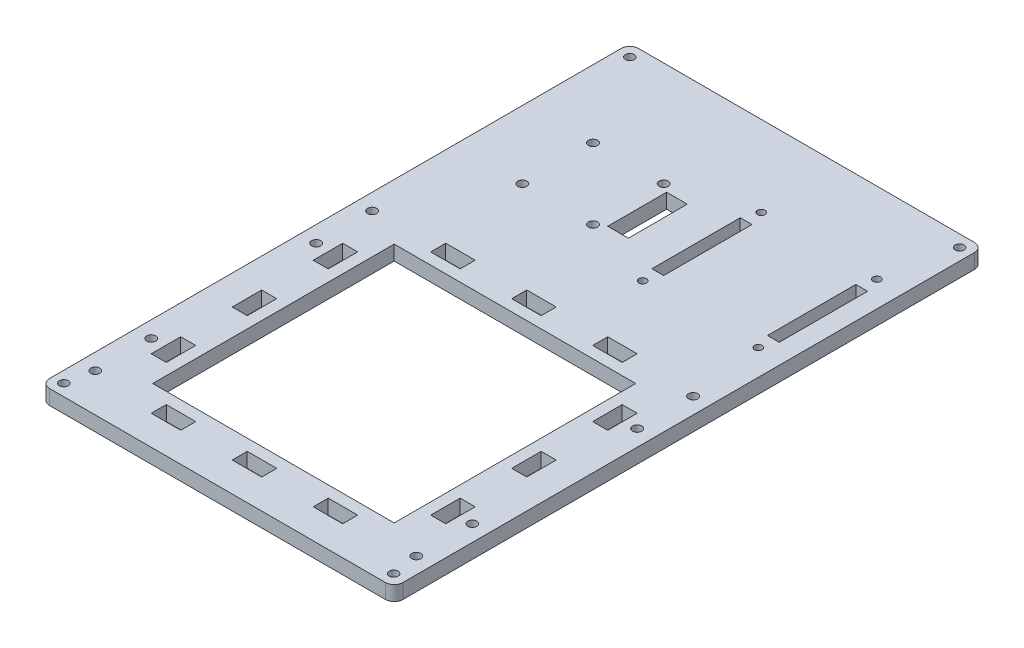
from build123d import *

# Parameters (mm, degrees)
SKETCH1_W           = 120
SKETCH1_H           = 200
SKETCH1_R           = 1.5
BOSS_EXTRUDE1_DEPTH = 5
CUT_EXTRUDE1_REACH  = 118.726
SKETCH4_W           = 5.1
SKETCH4_H           = 10
SKETCH4_W_2         = 10
SKETCH4_H_2         = 5.1
SKETCH4_W_3         = 82
SKETCH4_H_3         = 82
SKETCH5_R           = 1.55
SKETCH5_W           = 7.015063312
SKETCH5_H           = 20
CUT_EXTRUDE3_DEPTH  = 117.726175299
SKETCH6_W           = 4
SKETCH6_H           = 30
SKETCH6_R           = 1.3
CUT_EXTRUDE5_DEPTH  = 10
SKETCH7_R           = 1.55
CUT_EXTRUDE6_DEPTH  = 117.726175299
FILLET1_R           = 3


with BuildPart() as part:
    # Sketch1 → Boss-Extrude1 (new body)
    with BuildSketch(Plane(origin=(0, 0, 0), x_dir=(1, 0, 0), z_dir=(0, 1, 0))):
        Rectangle(SKETCH1_W, SKETCH1_H)
        with Locations(Location((-56, 96, 0), (0, 0, 270))):
            Circle(SKETCH1_R, mode=Mode.SUBTRACT)
        with Locations(Location((56, 96, 0), (0, 0, 270))):
            Circle(SKETCH1_R, mode=Mode.SUBTRACT)
        with Locations(Location((55.822222222, -96, 0), (0, 0, 270))):
            Circle(SKETCH1_R, mode=Mode.SUBTRACT)
        with Locations(Location((-56.177777778, -96, 0), (0, 0, 270))):
            Circle(SKETCH1_R, mode=Mode.SUBTRACT)
    extrude(amount=BOSS_EXTRUDE1_DEPTH)

    # Sketch4 → Cut-Extrude1 (cut, up to next)
    with BuildSketch(Plane(origin=(0, 5, 0), x_dir=(1, 0, 0), z_dir=(0, 1, 0)), mode=Mode.PRIVATE) as cut_extrude1_sk1:
        with Locations((-47.45, -12.5)):
            Rectangle(SKETCH4_W, SKETCH4_H)
    cut_extrude1_tool1 = extrude(cut_extrude1_sk1.sketch, amount=-CUT_EXTRUDE1_REACH, mode=Mode.PRIVATE) & part.part
    # Sketch4 → Cut-Extrude1 (cut, up to next)
    with BuildSketch(Plane(origin=(0, 5, 0), x_dir=(1, 0, 0), z_dir=(0, 1, 0)), mode=Mode.PRIVATE) as cut_extrude1_sk2:
        with Locations((-47.45, -67.5)):
            Rectangle(SKETCH4_W, SKETCH4_H)
    cut_extrude1_tool2 = extrude(cut_extrude1_sk2.sketch, amount=-CUT_EXTRUDE1_REACH, mode=Mode.PRIVATE) & part.part
    # Sketch4 → Cut-Extrude1 (cut, up to next)
    with BuildSketch(Plane(origin=(0, 5, 0), x_dir=(1, 0, 0), z_dir=(0, 1, 0)), mode=Mode.PRIVATE) as cut_extrude1_sk3:
        with Locations((-47.45, -40)):
            Rectangle(SKETCH4_W, SKETCH4_H)
    cut_extrude1_tool3 = extrude(cut_extrude1_sk3.sketch, amount=-CUT_EXTRUDE1_REACH, mode=Mode.PRIVATE) & part.part
    # Sketch4 → Cut-Extrude1 (cut, up to next)
    with BuildSketch(Plane(origin=(0, 5, 0), x_dir=(1, 0, 0), z_dir=(0, 1, 0)), mode=Mode.PRIVATE) as cut_extrude1_sk4:
        with Locations((-27.5, 7.45)):
            Rectangle(SKETCH4_W_2, SKETCH4_H_2)
    cut_extrude1_tool4 = extrude(cut_extrude1_sk4.sketch, amount=-CUT_EXTRUDE1_REACH, mode=Mode.PRIVATE) & part.part
    # Sketch4 → Cut-Extrude1 (cut, up to next)
    with BuildSketch(Plane(origin=(0, 5, 0), x_dir=(1, 0, 0), z_dir=(0, 1, 0)), mode=Mode.PRIVATE) as cut_extrude1_sk5:
        with Locations((0, 7.45)):
            Rectangle(SKETCH4_W_2, SKETCH4_H_2)
    cut_extrude1_tool5 = extrude(cut_extrude1_sk5.sketch, amount=-CUT_EXTRUDE1_REACH, mode=Mode.PRIVATE) & part.part
    # Sketch4 → Cut-Extrude1 (cut, up to next)
    with BuildSketch(Plane(origin=(0, 5, 0), x_dir=(1, 0, 0), z_dir=(0, 1, 0)), mode=Mode.PRIVATE) as cut_extrude1_sk6:
        with Locations((27.5, 7.45)):
            Rectangle(SKETCH4_W_2, SKETCH4_H_2)
    cut_extrude1_tool6 = extrude(cut_extrude1_sk6.sketch, amount=-CUT_EXTRUDE1_REACH, mode=Mode.PRIVATE) & part.part
    # Sketch4 → Cut-Extrude1 (cut, up to next)
    with BuildSketch(Plane(origin=(0, 5, 0), x_dir=(1, 0, 0), z_dir=(0, 1, 0)), mode=Mode.PRIVATE) as cut_extrude1_sk7:
        with Locations((47.45, -12.5)):
            Rectangle(SKETCH4_W, SKETCH4_H)
    cut_extrude1_tool7 = extrude(cut_extrude1_sk7.sketch, amount=-CUT_EXTRUDE1_REACH, mode=Mode.PRIVATE) & part.part
    # Sketch4 → Cut-Extrude1 (cut, up to next)
    with BuildSketch(Plane(origin=(0, 5, 0), x_dir=(1, 0, 0), z_dir=(0, 1, 0)), mode=Mode.PRIVATE) as cut_extrude1_sk8:
        with Locations((47.45, -40)):
            Rectangle(SKETCH4_W, SKETCH4_H)
    cut_extrude1_tool8 = extrude(cut_extrude1_sk8.sketch, amount=-CUT_EXTRUDE1_REACH, mode=Mode.PRIVATE) & part.part
    # Sketch4 → Cut-Extrude1 (cut, up to next)
    with BuildSketch(Plane(origin=(0, 5, 0), x_dir=(1, 0, 0), z_dir=(0, 1, 0)), mode=Mode.PRIVATE) as cut_extrude1_sk9:
        with Locations((47.45, -67.5)):
            Rectangle(SKETCH4_W, SKETCH4_H)
    cut_extrude1_tool9 = extrude(cut_extrude1_sk9.sketch, amount=-CUT_EXTRUDE1_REACH, mode=Mode.PRIVATE) & part.part
    # Sketch4 → Cut-Extrude1 (cut, up to next)
    with BuildSketch(Plane(origin=(0, 5, 0), x_dir=(1, 0, 0), z_dir=(0, 1, 0)), mode=Mode.PRIVATE) as cut_extrude1_sk10:
        with Locations((0, -87.45)):
            Rectangle(SKETCH4_W_2, SKETCH4_H_2)
    cut_extrude1_tool10 = extrude(cut_extrude1_sk10.sketch, amount=-CUT_EXTRUDE1_REACH, mode=Mode.PRIVATE) & part.part
    # Sketch4 → Cut-Extrude1 (cut, up to next)
    with BuildSketch(Plane(origin=(0, 5, 0), x_dir=(1, 0, 0), z_dir=(0, 1, 0)), mode=Mode.PRIVATE) as cut_extrude1_sk11:
        with Locations((-27.5, -87.45)):
            Rectangle(SKETCH4_W_2, SKETCH4_H_2)
    cut_extrude1_tool11 = extrude(cut_extrude1_sk11.sketch, amount=-CUT_EXTRUDE1_REACH, mode=Mode.PRIVATE) & part.part
    # Sketch4 → Cut-Extrude1 (cut, up to next)
    with BuildSketch(Plane(origin=(0, 5, 0), x_dir=(1, 0, 0), z_dir=(0, 1, 0)), mode=Mode.PRIVATE) as cut_extrude1_sk12:
        with Locations((27.5, -87.45)):
            Rectangle(SKETCH4_W_2, SKETCH4_H_2)
    cut_extrude1_tool12 = extrude(cut_extrude1_sk12.sketch, amount=-CUT_EXTRUDE1_REACH, mode=Mode.PRIVATE) & part.part
    # Sketch4 → Cut-Extrude1 (cut, up to next)
    with BuildSketch(Plane(origin=(0, 5, 0), x_dir=(1, 0, 0), z_dir=(0, 1, 0)), mode=Mode.PRIVATE) as cut_extrude1_sk13:
        with Locations((0, -40)):
            Rectangle(SKETCH4_W_3, SKETCH4_H_3)
    cut_extrude1_tool13 = extrude(cut_extrude1_sk13.sketch, amount=-CUT_EXTRUDE1_REACH, mode=Mode.PRIVATE) & part.part
    add(cut_extrude1_tool1.solids().sort_by_distance((-47.45, 5, 12.5))[0], mode=Mode.SUBTRACT)
    add(cut_extrude1_tool2.solids().sort_by_distance((-47.45, 5, 67.5))[0], mode=Mode.SUBTRACT)
    add(cut_extrude1_tool3.solids().sort_by_distance((-47.45, 5, 40))[0], mode=Mode.SUBTRACT)
    add(cut_extrude1_tool4.solids().sort_by_distance((-27.5, 5, -7.45))[0], mode=Mode.SUBTRACT)
    add(cut_extrude1_tool5.solids().sort_by_distance((0, 5, -7.45))[0], mode=Mode.SUBTRACT)
    add(cut_extrude1_tool6.solids().sort_by_distance((27.5, 5, -7.45))[0], mode=Mode.SUBTRACT)
    add(cut_extrude1_tool7.solids().sort_by_distance((47.45, 5, 12.5))[0], mode=Mode.SUBTRACT)
    add(cut_extrude1_tool8.solids().sort_by_distance((47.45, 5, 40))[0], mode=Mode.SUBTRACT)
    add(cut_extrude1_tool9.solids().sort_by_distance((47.45, 5, 67.5))[0], mode=Mode.SUBTRACT)
    add(cut_extrude1_tool10.solids().sort_by_distance((0, 5, 87.45))[0], mode=Mode.SUBTRACT)
    add(cut_extrude1_tool11.solids().sort_by_distance((-27.5, 5, 87.45))[0], mode=Mode.SUBTRACT)
    add(cut_extrude1_tool12.solids().sort_by_distance((27.5, 5, 87.45))[0], mode=Mode.SUBTRACT)
    add(cut_extrude1_tool13.solids().sort_by_distance((0, 5, 40))[0], mode=Mode.SUBTRACT)

    # Sketch5 → Cut-Extrude3 (cut, through all)
    with BuildSketch(Plane(origin=(0, 5, 0), x_dir=(1, 0, 0), z_dir=(0, 1, 0))):
        with Locations(Location((-37, 64.5, 0), (0, 0, 270))):
            Circle(SKETCH5_R)
        with Locations(Location((-13, 64.5, 0), (0, 0, 270))):
            Circle(SKETCH5_R)
        with Locations(Location((-13, 40.5, 0), (0, 0, 270))):
            Circle(SKETCH5_R)
        with Locations(Location((-37, 40.5, 0), (0, 0, 270))):
            Circle(SKETCH5_R)
        with Locations((-6.492468344, 52.5)):
            Rectangle(SKETCH5_W, SKETCH5_H)
    extrude(amount=-CUT_EXTRUDE3_DEPTH, mode=Mode.SUBTRACT)

    # Sketch6 → Cut-Extrude5 (cut)
    with BuildSketch(Plane(origin=(0, 5, 0), x_dir=(1, 0, 0), z_dir=(0, 1, 0))):
        with Locations((12, 52.5)):
            Rectangle(SKETCH6_W, SKETCH6_H)
        with Locations((51.25, 52.5)):
            Rectangle(SKETCH6_W, SKETCH6_H)
        with Locations(Location((51.25, 72.625, 0), (0, 0, 270))):
            Circle(SKETCH6_R)
        with Locations(Location((12, 72.625, 0), (0, 0, 270))):
            Circle(SKETCH6_R)
        with Locations(Location((12, 32.375, 0), (0, 0, 270))):
            Circle(SKETCH6_R)
        with Locations(Location((51.25, 32.375, 0), (0, 0, 270))):
            Circle(SKETCH6_R)
    extrude(amount=-CUT_EXTRUDE5_DEPTH, mode=Mode.SUBTRACT)

    # Sketch7 → Cut-Extrude6 (cut, through all)
    with BuildSketch(Plane(origin=(0, 5, 0), x_dir=(1, 0, 0), z_dir=(0, 1, 0))):
        with Locations(Location((-54.5, 7, 0), (0, 0, 270))):
            Circle(SKETCH7_R)
        with Locations(Location((-54.5, -12, 0), (0, 0, 270))):
            Circle(SKETCH7_R)
        with Locations(Location((-54.5, -68, 0), (0, 0, 90))):
            Circle(SKETCH7_R)
        with Locations(Location((-54.5, -87, 0), (0, 0, 90))):
            Circle(SKETCH7_R)
        with Locations(Location((54.5, -12, 0), (0, 0, 90))):
            Circle(SKETCH7_R)
        with Locations(Location((54.5, 7, 0), (0, 0, 90))):
            Circle(SKETCH7_R)
        with Locations(Location((54.5, -87, 0), (0, 0, 270))):
            Circle(SKETCH7_R)
        with Locations(Location((54.5, -68, 0), (0, 0, 270))):
            Circle(SKETCH7_R)
    extrude(amount=-CUT_EXTRUDE6_DEPTH, mode=Mode.SUBTRACT)

    # Fillet1
    fillet1_edges = [part.edges().sort_by_distance(p)[0] for p in [
        (-60, 2.5, 100),
        (-60, 2.5, -100),
        (60, 2.5, -100),
        (60, 2.5, 100),
    ]]
    fillet(fillet1_edges, radius=FILLET1_R)


solid = part.part
